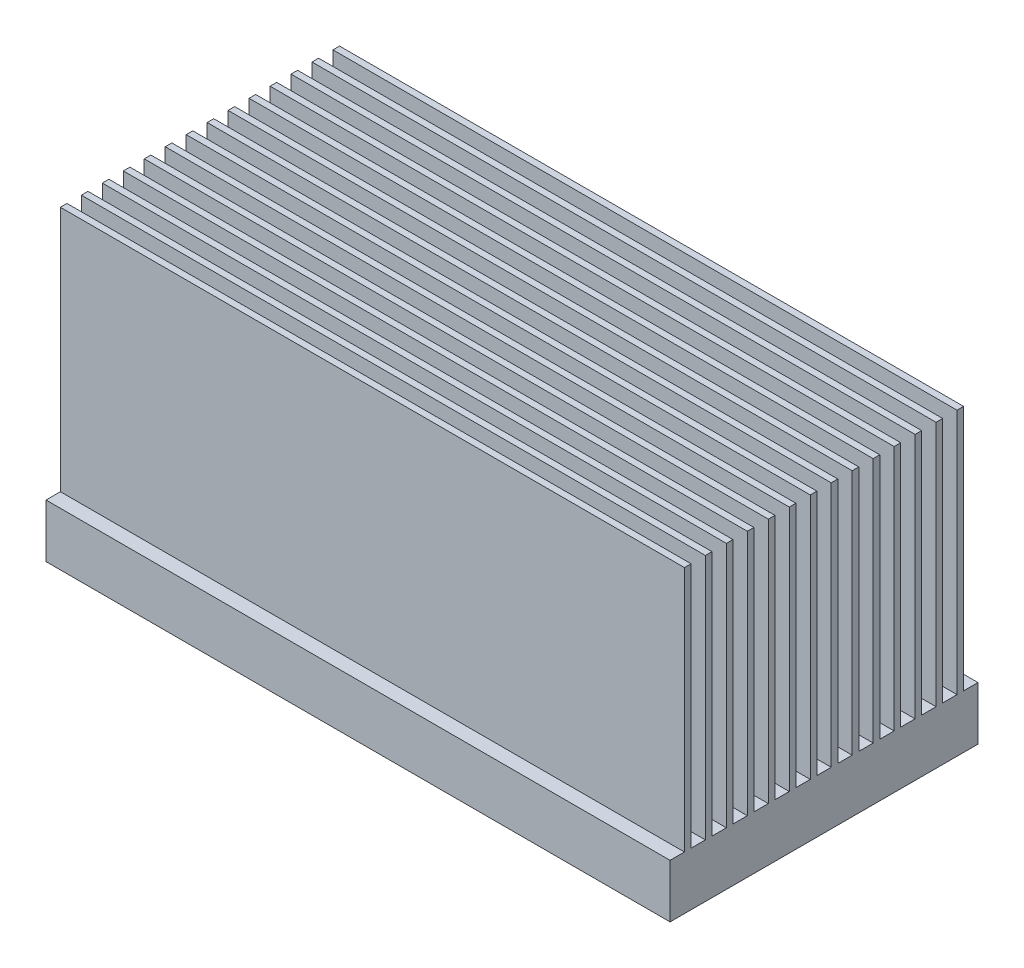
from build123d import *

# Parameters (mm, degrees)
SKETCH1_W           = 152
SKETCH1_H           = 75
BOSS_EXTRUDE1_DEPTH = 73
SKETCH2_W           = 152
SKETCH2_H           = 3.5
CUT_EXTRUDE1_DEPTH  = 60


with BuildPart() as part:
    # Sketch1 → Boss-Extrude1 (new body)
    with BuildSketch(Plane(origin=(0, 0, 0), x_dir=(1, 0, 0), z_dir=(0, 1, 0))):
        with Locations((76, 37.5)):
            Rectangle(SKETCH1_W, SKETCH1_H)
    extrude(amount=BOSS_EXTRUDE1_DEPTH)

    # Sketch2 → Cut-Extrude1 (cut)
    with BuildSketch(Plane(origin=(0, 73, 0), x_dir=(1, 0, 0), z_dir=(0, 1, 0))):
        with Locations((76, 1.75)):
            Rectangle(SKETCH2_W, SKETCH2_H)
        with Locations((76, 6.857142857)):
            Rectangle(SKETCH2_W, SKETCH2_H)
        with Locations((76, 11.964285714)):
            Rectangle(SKETCH2_W, SKETCH2_H)
        with Locations((76, 17.071428571)):
            Rectangle(SKETCH2_W, SKETCH2_H)
        with Locations((76, 22.178571429)):
            Rectangle(SKETCH2_W, SKETCH2_H)
        with Locations((76, 27.285714286)):
            Rectangle(SKETCH2_W, SKETCH2_H)
        with Locations((76, 32.392857143)):
            Rectangle(SKETCH2_W, SKETCH2_H)
        with Locations((76, 37.5)):
            Rectangle(SKETCH2_W, SKETCH2_H)
        with Locations((76, 42.607142857)):
            Rectangle(SKETCH2_W, SKETCH2_H)
        with Locations((76, 47.714285714)):
            Rectangle(SKETCH2_W, SKETCH2_H)
        with Locations((76, 52.821428571)):
            Rectangle(SKETCH2_W, SKETCH2_H)
        with Locations((76, 57.928571429)):
            Rectangle(SKETCH2_W, SKETCH2_H)
        with Locations((76, 63.035714286)):
            Rectangle(SKETCH2_W, SKETCH2_H)
        with Locations((76, 68.142857143)):
            Rectangle(SKETCH2_W, SKETCH2_H)
        with Locations((76, 73.25)):
            Rectangle(SKETCH2_W, SKETCH2_H)
    extrude(amount=-CUT_EXTRUDE1_DEPTH, mode=Mode.SUBTRACT)


solid = part.part
